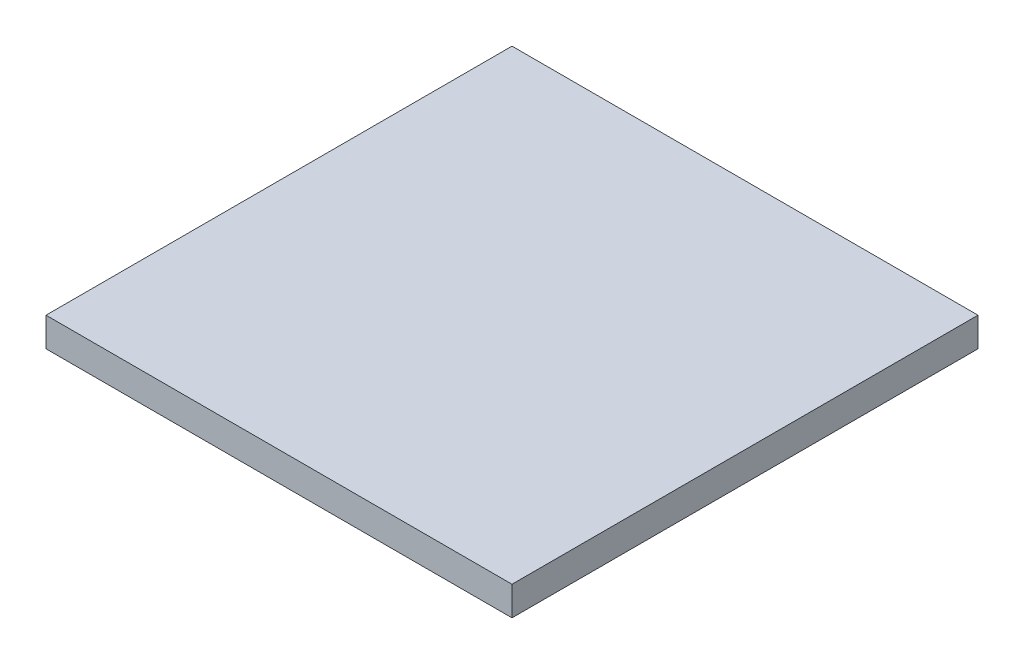
from build123d import *

# Parameters (mm, degrees)
SKETCH1_W           = 101.6
SKETCH1_H           = 101.6
BOSS_EXTRUDE1_DEPTH = 6.35


with BuildPart() as part:
    # Sketch1 → Boss-Extrude1 (new body)
    with BuildSketch(Plane(origin=(0, 0, 0), x_dir=(1, 0, 0), z_dir=(0, 1, 0))):
        with Locations((-50.8, 50.8)):
            Rectangle(SKETCH1_W, SKETCH1_H)
    extrude(amount=BOSS_EXTRUDE1_DEPTH)


solid = part.part
